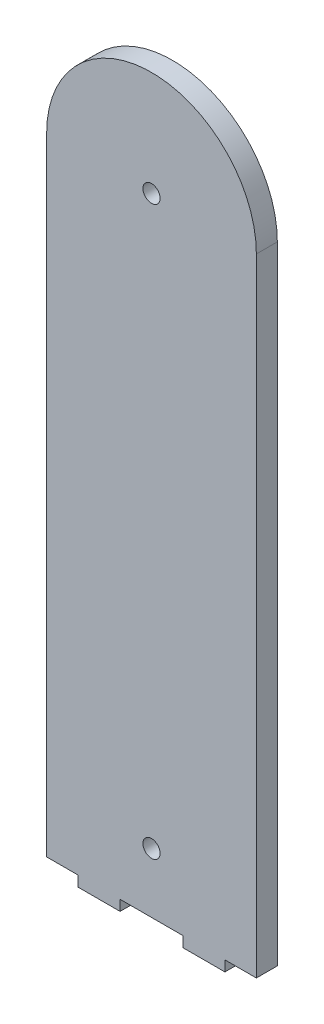
from build123d import *

# Parameters (mm, degrees)
SKETCH_1_R      = 4.1
EXTRUDE_1_DEPTH = 10


with BuildPart() as part:
    # 草圖1 → 填料-伸長1 (new body)
    with BuildSketch(Plane.XY):
        with BuildLine():
            Line((-50, 0), (-35, 0))
            Line((-35, 0), (-35, -5))
            Line((-35, -5), (-15, -5))
            Line((-15, -5), (-15, 0))
            Line((-15, 0), (15, 0))
            Line((15, 0), (15, -5))
            Line((15, -5), (35, -5))
            Line((35, -5), (35, 0))
            Line((35, 0), (50, 0))
            Line((50, 0), (50, 299))
            ThreePointArc((50, 299), (0, 349), (-50, 299))
            Line((-50, 299), (-50, 0))
        make_face()
        with Locations((0, 299)):
            Circle(SKETCH_1_R, mode=Mode.SUBTRACT)
        with Locations((0, 28.5)):
            Circle(SKETCH_1_R, mode=Mode.SUBTRACT)
    extrude(amount=-EXTRUDE_1_DEPTH)


solid = part.part
